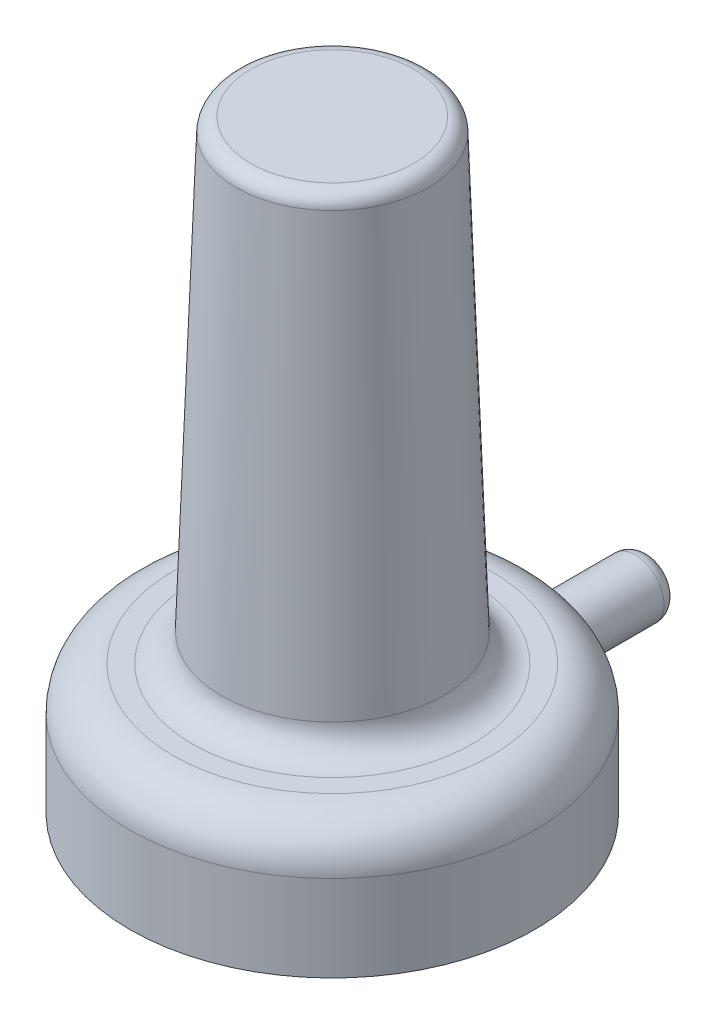
from build123d import *

# Parameters (mm, degrees)
SKETCH1_R           = 17.907
BOSS_EXTRUDE1_DEPTH = 53.34
SKETCH2_OUTSIDE_W   = 55.452
SKETCH2_OUTSIDE_H   = 55.452
SKETCH2_OUTSIDE_R   = 9.906
CUT_EXTRUDE1_DEPTH  = 41.91
CUT_EXTRUDE1_DRAFT  = -2
FILLET1_R           = 1.27
FILLET2_R           = 3.81
FILLET3_R           = 2.54
SKETCH4_R           = 2.54
BOSS_EXTRUDE3_DEPTH = 28.067
FILLET4_R           = 1.27


with BuildPart() as part:
    # Sketch1 → Boss-Extrude1 (new body)
    with BuildSketch(Plane(origin=(0, 0, 0), x_dir=(1, 0, 0), z_dir=(0, 1, 0))):
        with Locations(Location((0, 0, 0), (0, 0, 270))):
            Circle(SKETCH1_R)
    extrude(amount=BOSS_EXTRUDE1_DEPTH)


with BuildPart() as cut_extrude1_tool:
    # Sketch2 outside → Cut-Extrude1 (with draft: the straight prism first)
    with BuildSketch(Plane(origin=(0, 11.43, 0), x_dir=(1, 0, 0), z_dir=(0, 1, 0))):
        Rectangle(SKETCH2_OUTSIDE_W, SKETCH2_OUTSIDE_H)
        Circle(SKETCH2_OUTSIDE_R, mode=Mode.SUBTRACT)
    extrude(amount=CUT_EXTRUDE1_DEPTH)
    # Cut-Extrude1: the draft: its side faces are tilted about the plane it starts from
    cut_extrude1_sides = [cut_extrude1_tool.faces().sort_by_distance(p)[0] for p in [
        (0, 32.385, 27.726),
        (27.726, 32.385, 0),
        (0, 32.385, -27.726),
        (-27.726, 32.385, 0),
        (-9.906, 32.385, 0),
    ]]
    draft(cut_extrude1_sides, Plane(origin=(0, 11.43, 0), x_dir=(1, 0, 0), z_dir=(0, 1, 0)), CUT_EXTRUDE1_DRAFT)


with BuildPart() as part_1:
    add(part.part)

    # Cut-Extrude1: cut by cut_extrude1_tool
    add(cut_extrude1_tool.part, mode=Mode.SUBTRACT)

    # Fillet1
    fillet1_edges = [part_1.edges().sort_by_distance(p)[0] for p in [
        (-8.442470551, 53.34, 0),
    ]]
    fillet(fillet1_edges, radius=FILLET1_R)

    # Fillet2
    fillet2_edges = [part_1.edges().sort_by_distance(p)[0] for p in [
        (0, 11.43, -17.907),
    ]]
    fillet(fillet2_edges, radius=FILLET2_R)

    # Fillet3
    fillet3_edges = [part_1.edges().sort_by_distance(p)[0] for p in [
        (-9.906, 11.43, 0),
    ]]
    fillet(fillet3_edges, radius=FILLET3_R)

    # Sketch4 → Boss-Extrude3 (add)
    with BuildSketch(Plane.XY):
        with Locations((0, 3.81)):
            Circle(SKETCH4_R)
    extrude(amount=-BOSS_EXTRUDE3_DEPTH)

    # Fillet4
    fillet4_edges = [part_1.edges().sort_by_distance(p)[0] for p in [
        (-2.54, 3.81, -28.067),
    ]]
    fillet(fillet4_edges, radius=FILLET4_R)


solid = part_1.part
